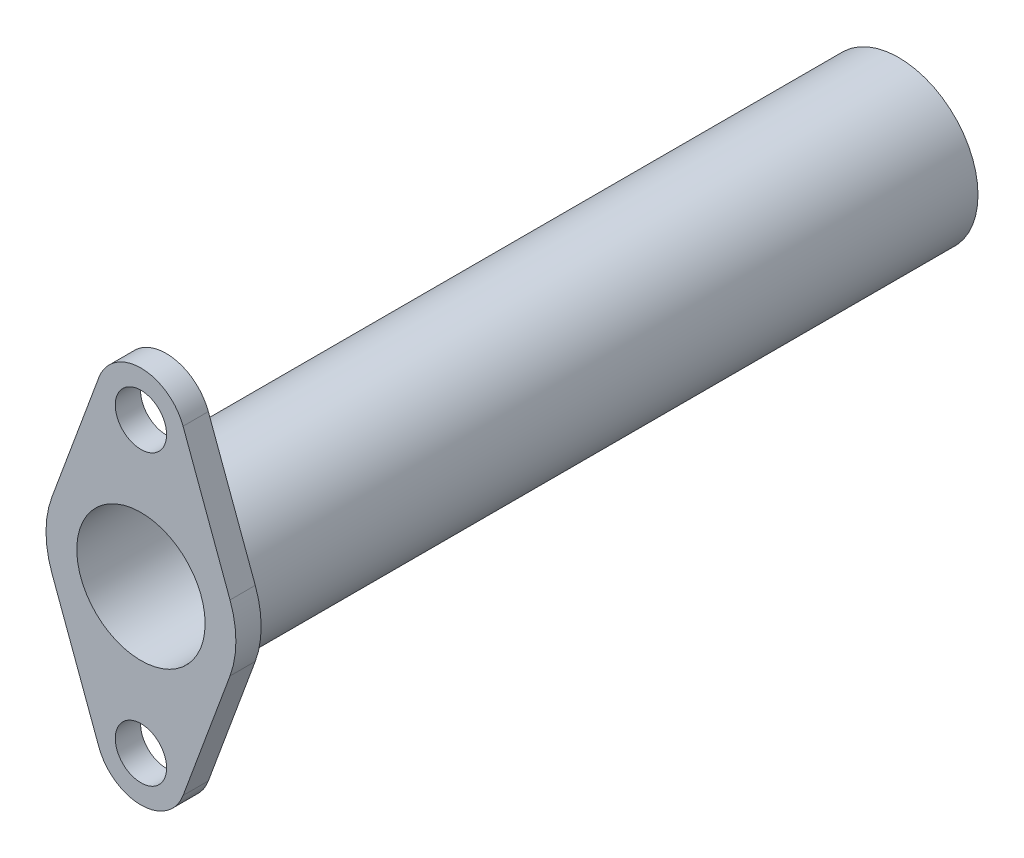
from build123d import *

# Parameters (mm, degrees)
SKETCH1_R           = 5.08
SKETCH1_R_2         = 12.7
BOSS_EXTRUDE1_DEPTH = 5
SKETCH2_R           = 15.7
SKETCH2_R_2         = 12.7
BOSS_EXTRUDE2_DEPTH = 150


with BuildPart() as part:
    # Sketch1 → Boss-Extrude1 (new body)
    with BuildSketch(Plane.XY):
        with BuildLine():
            Line((17.630429803, 6.515946667), (8.338716799, 31.656866667))
            ThreePointArc((8.338716799, 31.656866667), (0, 37.465), (-8.338716799, 31.656866667))
            Line((-8.338716799, 31.656866667), (-17.630429803, 6.515946667))
            ThreePointArc((-17.630429803, 6.515946667), (-18.796, 0), (-17.630429803, -6.515946667))
            Line((-17.630429803, -6.515946667), (-8.338716799, -31.656866667))
            ThreePointArc((-8.338716799, -31.656866667), (0, -37.465), (8.338716799, -31.656866667))
            Line((8.338716799, -31.656866667), (17.630429803, -6.515946667))
            ThreePointArc((17.630429803, -6.515946667), (18.796, 0), (17.630429803, 6.515946667))
        make_face()
        with Locations((0, 28.575)):
            Circle(SKETCH1_R, mode=Mode.SUBTRACT)
        Circle(SKETCH1_R_2, mode=Mode.SUBTRACT)
        with Locations((0, -28.575)):
            Circle(SKETCH1_R, mode=Mode.SUBTRACT)
    extrude(amount=-BOSS_EXTRUDE1_DEPTH)

    # Sketch2 → Boss-Extrude2 (add)
    with BuildSketch(Plane.XY):
        Circle(SKETCH2_R)
        Circle(SKETCH2_R_2, mode=Mode.SUBTRACT)
    extrude(amount=-BOSS_EXTRUDE2_DEPTH)


solid = part.part
